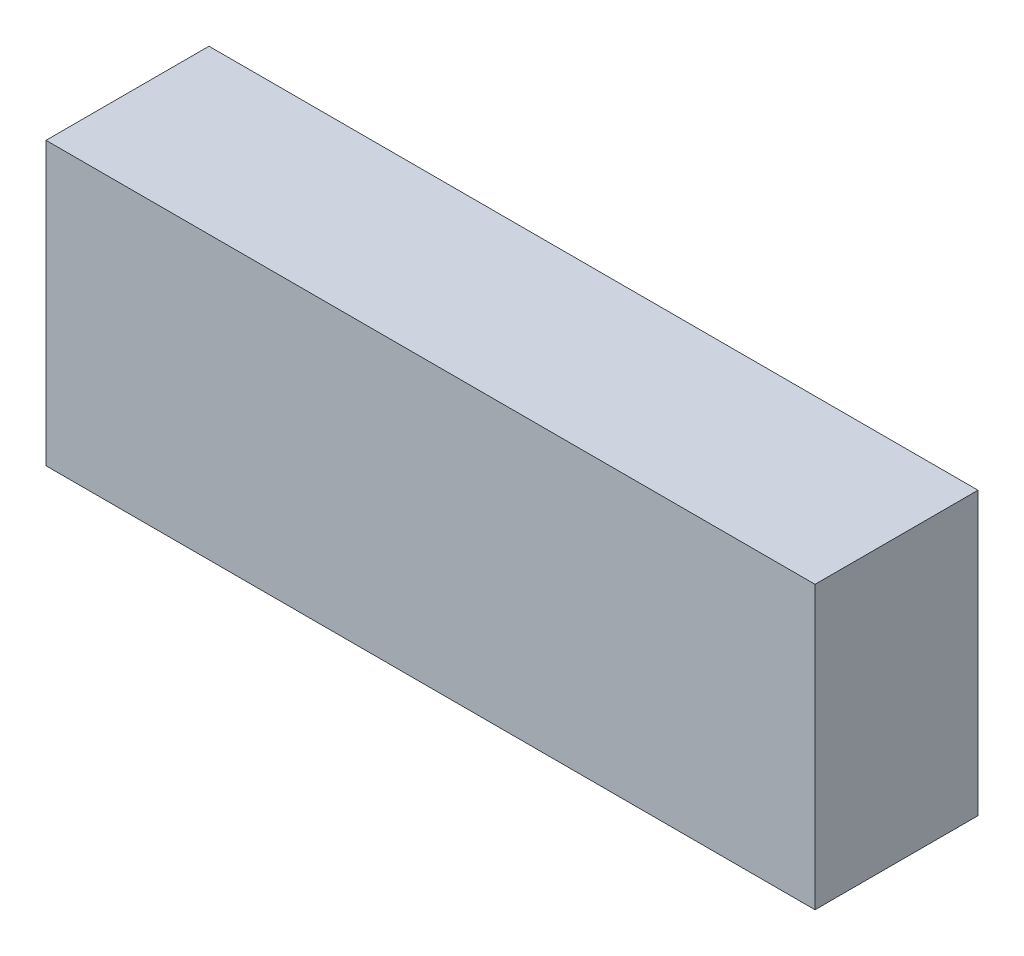
from build123d import *

# Parameters (mm, degrees)
SKETCH1_W                 = 34.21230149
SKETCH1_H                 = 12.54
BOSS_EXTRUDE1_DEPTH       = 7.25
SHELL1_T                  = -0.5
SHELL1_THICKNESS_2_FACE_W = 33.21230149
SHELL1_THICKNESS_2_FACE_H = 11.54
SHELL1_THICKNESS_2_DEPTH  = 0.3


with BuildPart() as part:
    # Sketch1 → Boss-Extrude1 (new body)
    with BuildSketch(Plane.XY):
        with Locations((61.930650745, -7.96)):
            Rectangle(SKETCH1_W, SKETCH1_H)
    extrude(amount=BOSS_EXTRUDE1_DEPTH)

    # Shell1
    shell1_openings = [part.faces().sort_by_distance(p)[0] for p in [
        (61.930650745, -7.96, 0),
    ]]
    offset(amount=SHELL1_T, openings=shell1_openings, kind=Kind.INTERSECTION)

    # Shell1 thickness 2 face (on inner face of the shell) → Shell1 thickness 2 (cut)
    with BuildSketch(Plane(origin=(61.930650745, -7.96, 6.75), x_dir=(1, 0, 0), z_dir=(0, 0, 1))):
        Rectangle(SHELL1_THICKNESS_2_FACE_W, SHELL1_THICKNESS_2_FACE_H)
    extrude(amount=SHELL1_THICKNESS_2_DEPTH, mode=Mode.SUBTRACT)


solid = part.part
